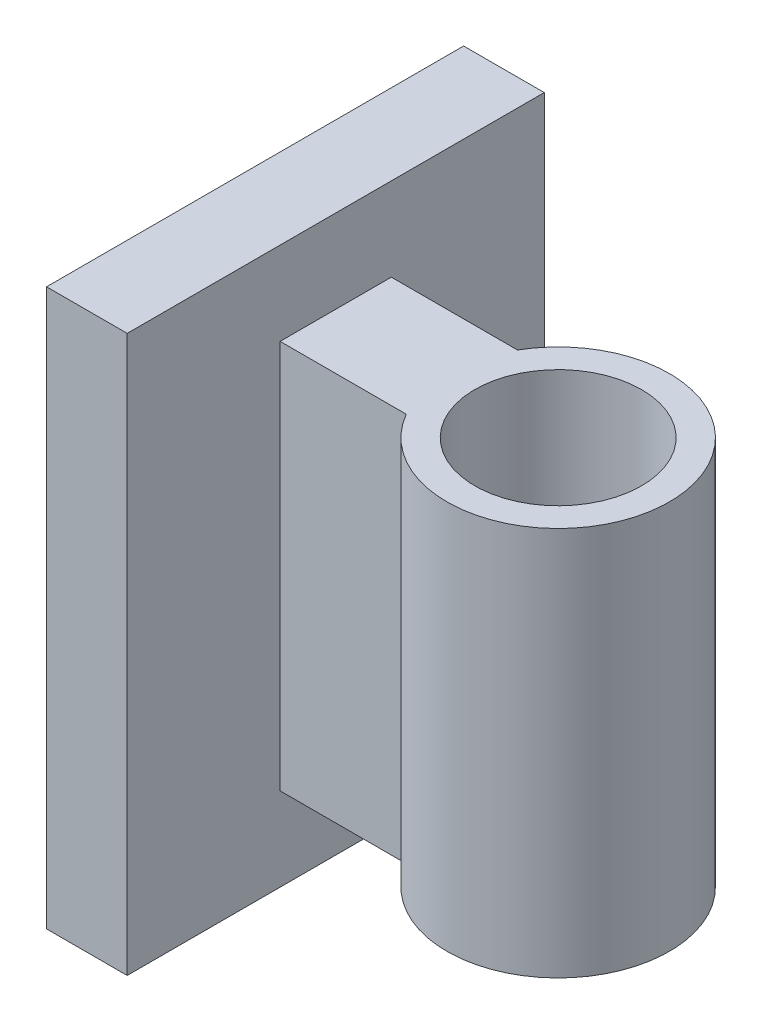
from build123d import *

# Parameters (mm, degrees)
SKETCH1_W                = 15
SKETCH1_H                = 20
BOSS_EXTRUDE1_DEPTH      = 2.9
SKETCH2_W                = 1
SKETCH2_H                = 14
BOSS_EXTRUDE2_REACH      = 29.731
BOSS_EXTRUDE2_END_RADIUS = 4
SKETCH4_W                = 4
SKETCH4_H                = 14


with BuildPart() as part:
    # Sketch1 → Boss-Extrude1 (new body)
    with BuildSketch(Plane(origin=(0, 0, 0), x_dir=(0, 0, -1), z_dir=(1, 0, 0))):
        with Locations((7.5, 10)):
            Rectangle(SKETCH1_W, SKETCH1_H)
    extrude(amount=BOSS_EXTRUDE1_DEPTH)



with BuildPart() as body_2:
    # Sketch2 → Revolve1 (revolve)
    with BuildSketch(Plane(origin=(10.9, 0, 0), x_dir=(0, 0, -1), z_dir=(1, 0, 0))):
        with Locations((11, 10)):
            Rectangle(SKETCH2_W, SKETCH2_H)
    revolve(axis=Axis((10.9, 0, -7.5), (0, 1, 0)))


with BuildPart() as part_1:
    add(part.part)

    add(body_2.part)  # Boss-Extrude2 merges body 2
    # Boss-Extrude2: up to this cylinder (the profile starts outside it)
    boss_extrude2_end = Plane(origin=(10.9, 10, -7.5), z_dir=(0, -1, 0)) * Cylinder(BOSS_EXTRUDE2_END_RADIUS, 68.462, mode=Mode.PRIVATE)
    # Sketch4 → Boss-Extrude2 (add, up to the surface)
    with BuildSketch(Plane(origin=(2.9, 0, 0), x_dir=(0, 0, -1), z_dir=(1, 0, 0)), mode=Mode.PRIVATE) as boss_extrude2_sk1:
        with Locations((7.5, 10)):
            Rectangle(SKETCH4_W, SKETCH4_H)
    boss_extrude2_tool1 = extrude(boss_extrude2_sk1.sketch, amount=BOSS_EXTRUDE2_REACH, mode=Mode.PRIVATE) - boss_extrude2_end
    add(boss_extrude2_tool1.solids().sort_by_distance((2.9, 10, -7.5))[0])


solid = part_1.part
